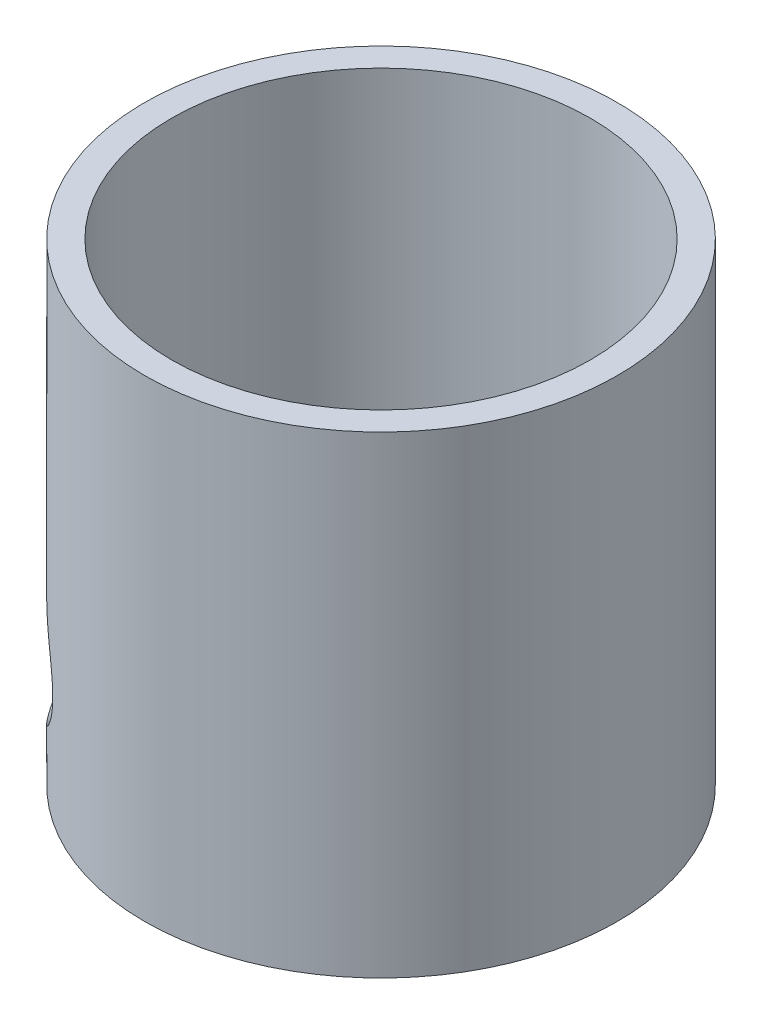
from build123d import *

# Parameters (mm, degrees)
SKETCH3_R           = 87.5
SKETCH3_R_2         = 77.5
BOSS_EXTRUDE1_DEPTH = 175
SKETCH3_2_R         = 77.5
BOSS_EXTRUDE2_DEPTH = 5
SKETCH4_R           = 25
CUT_EXTRUDE1_DEPTH  = 215.330352494


with BuildPart() as part:
    # Sketch3 → Boss-Extrude1 (new body)
    with BuildSketch(Plane(origin=(0, 0, 0), x_dir=(1, 0, 0), z_dir=(0, 1, 0))):
        Circle(SKETCH3_R)
        Circle(SKETCH3_R_2, mode=Mode.SUBTRACT)
    extrude(amount=BOSS_EXTRUDE1_DEPTH)

    # Sketch3<2> → Boss-Extrude2 (add)
    with BuildSketch(Plane(origin=(0, 0, 0), x_dir=(1, 0, 0), z_dir=(0, 1, 0))):
        Circle(SKETCH3_2_R)
    extrude(amount=BOSS_EXTRUDE2_DEPTH)

    # Sketch4 → Cut-Extrude1 (cut, through all)
    with BuildSketch(Plane(origin=(0, 0, 0), x_dir=(0, 0, -1), z_dir=(1, 0, 0))):
        with Locations((-47.5, 40)):
            Circle(SKETCH4_R)
    extrude(amount=-CUT_EXTRUDE1_DEPTH, mode=Mode.SUBTRACT)


solid = part.part
